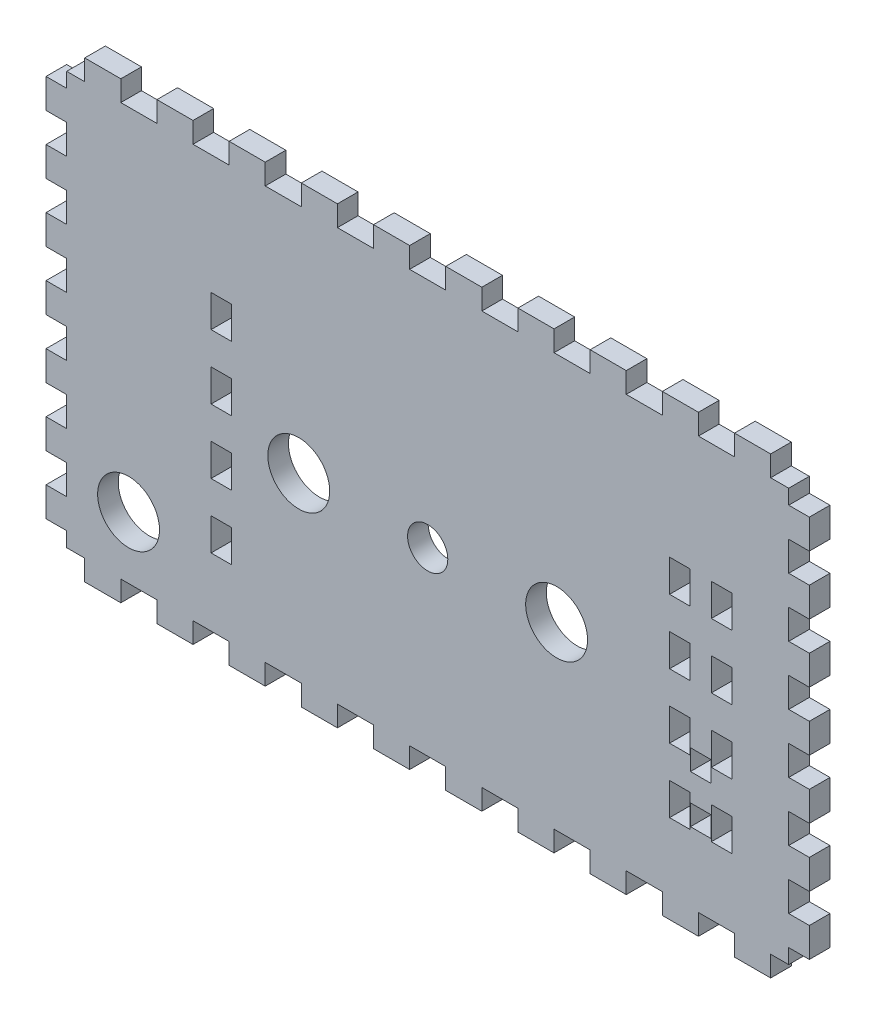
from build123d import *

# Parameters (mm, degrees)
SCHIZZO1_W                   = 140
SCHIZZO1_H                   = 80
SCHIZZO1_R                   = 6
SCHIZZO1_R_2                 = 3.9
ESTRUSIONE_ESTRUSIONE1_DEPTH = 4
SCHIZZO2_W                   = 7
SCHIZZO2_H                   = 4
ESTRUSIONE_ESTRUSIONE2_DEPTH = 4
RIPETIZIONE_A_L1_COUNT       = 10
RIPETIZIONE_A_L1_PITCH       = 14
SCHIZZO3_W                   = 4
SCHIZZO3_H                   = 5.714285714
ESTRUSIONE_ESTRUSIONE3_DEPTH = 4
RIPETIZIONE_A_L2_COUNT       = 7
RIPETIZIONE_A_L2_PITCH       = 11.428571429
SCHIZZO4_W                   = 4
SCHIZZO4_H                   = 6.25
TAGLIO_ESTRUSIONE1_DEPTH     = 167.757308685
RIPETIZIONE_A_L3_COUNT       = 4
RIPETIZIONE_A_L3_PITCH       = 12.5
SCHIZZO5_W                   = 4
SCHIZZO5_H                   = 6.25
TAGLIO_ESTRUSIONE2_DEPTH     = 167.757308685
RIPETIZIONE_A_L4_COUNT       = 4
RIPETIZIONE_A_L4_PITCH       = 12.5
SCHIZZO6_W                   = 4
SCHIZZO6_H                   = 4
TAGLIO_ESTRUSIONE3_DEPTH     = 167.757308685


with BuildPart() as part:
    # Schizzo1 → Estrusione-Estrusione1 (new body)
    with BuildSketch(Plane.XY):
        with Locations((70, 40)):
            Rectangle(SCHIZZO1_W, SCHIZZO1_H)
        with Locations((45, 35)):
            Circle(SCHIZZO1_R, mode=Mode.SUBTRACT)
        with Locations((95, 35)):
            Circle(SCHIZZO1_R, mode=Mode.SUBTRACT)
        with Locations((12, 12)):
            Circle(SCHIZZO1_R, mode=Mode.SUBTRACT)
        with Locations((70, 35)):
            Circle(SCHIZZO1_R_2, mode=Mode.SUBTRACT)
    extrude(amount=ESTRUSIONE_ESTRUSIONE1_DEPTH)

    # Schizzo2 → Estrusione-Estrusione2 (add)
    with BuildSketch(Plane.XY.offset(4)):
        with Locations((7, 82)):
            Rectangle(SCHIZZO2_W, SCHIZZO2_H)
        with Locations((7, -2)):
            Rectangle(SCHIZZO2_W, SCHIZZO2_H)
    estrusione_estrusione2 = extrude(amount=-ESTRUSIONE_ESTRUSIONE2_DEPTH)

    # Ripetizione a L1: Estrusione-Estrusione2 ×10
    with Locations(*[(i * RIPETIZIONE_A_L1_PITCH, 0, 0) for i in range(1, RIPETIZIONE_A_L1_COUNT)]):
        add(estrusione_estrusione2)

    # Schizzo3 → Estrusione-Estrusione3 (add)
    with BuildSketch(Plane.XY.offset(4)):
        with Locations((-2, 74.285714286)):
            Rectangle(SCHIZZO3_W, SCHIZZO3_H)
        with Locations((142, 74.285714286)):
            Rectangle(SCHIZZO3_W, SCHIZZO3_H)
    estrusione_estrusione3 = extrude(amount=-ESTRUSIONE_ESTRUSIONE3_DEPTH)

    # Ripetizione a L2: Estrusione-Estrusione3 ×7
    with Locations(*[(0, -i * RIPETIZIONE_A_L2_PITCH, 0) for i in range(1, RIPETIZIONE_A_L2_COUNT)]):
        add(estrusione_estrusione3)

    # Schizzo4 → Taglio-Estrusione1 (cut, through all)
    with BuildSketch(Plane.XY.offset(4)):
        with Locations((30, 53.75)):
            Rectangle(SCHIZZO4_W, SCHIZZO4_H)
    taglio_estrusione1 = extrude(amount=-TAGLIO_ESTRUSIONE1_DEPTH, mode=Mode.SUBTRACT)

    # Ripetizione a L3: Taglio-Estrusione1 ×4
    with Locations(*[(0, -i * RIPETIZIONE_A_L3_PITCH, 0) for i in range(1, RIPETIZIONE_A_L3_COUNT)]):
        add(taglio_estrusione1, mode=Mode.SUBTRACT)

    # Schizzo5 → Taglio-Estrusione2 (cut, through all)
    with BuildSketch(Plane(origin=(0, 0, 0), x_dir=(-1, 0, 0), z_dir=(0, 0, -1))):
        with Locations((-127, 53.75)):
            Rectangle(SCHIZZO5_W, SCHIZZO5_H)
        with Locations((-118.9, 53.75)):
            Rectangle(SCHIZZO5_W, SCHIZZO5_H)
    taglio_estrusione2 = extrude(amount=-TAGLIO_ESTRUSIONE2_DEPTH, mode=Mode.SUBTRACT)

    # Ripetizione a L4: Taglio-Estrusione2 ×4
    with Locations(*[(0, -i * RIPETIZIONE_A_L4_PITCH, 0) for i in range(1, RIPETIZIONE_A_L4_COUNT)]):
        add(taglio_estrusione2, mode=Mode.SUBTRACT)

    # Schizzo6 → Taglio-Estrusione3 (cut, through all)
    with BuildSketch(Plane(origin=(0, 0, 0), x_dir=(-1, 0, 0), z_dir=(0, 0, -1))):
        with Locations((-122.95, 15.634824405)):
            Rectangle(SCHIZZO6_W, SCHIZZO6_H)
        with Locations((-122.95, 24.894824405)):
            Rectangle(SCHIZZO6_W, SCHIZZO6_H)
    extrude(amount=-TAGLIO_ESTRUSIONE3_DEPTH, mode=Mode.SUBTRACT)


solid = part.part
